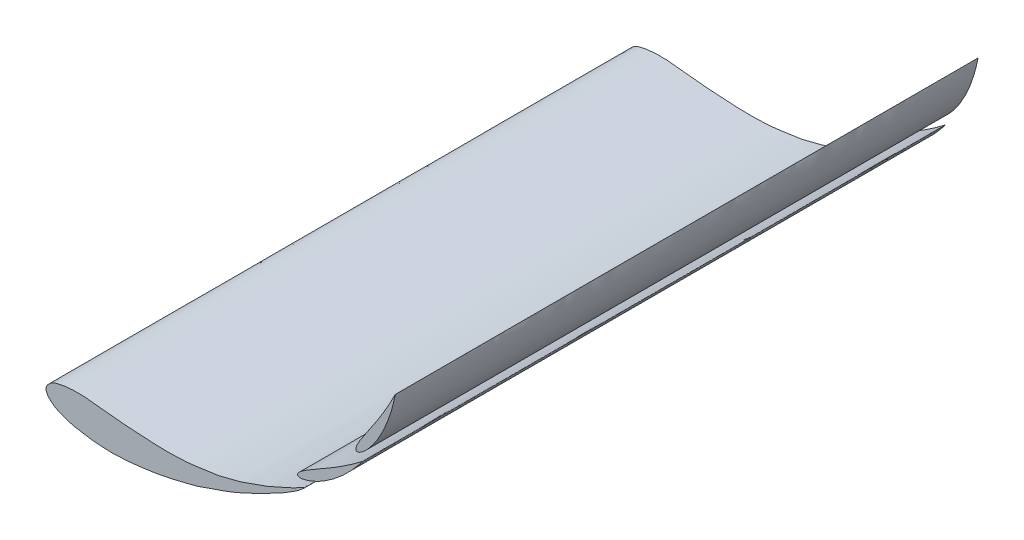
from build123d import *

# Parameters (mm, degrees)
BOSS_EXTRUDE1_DEPTH   = 900
BOSS_EXTRUDE1_2_DEPTH = 900
BOSS_EXTRUDE1_3_DEPTH = 900


with BuildPart() as part:
    # Sketch2 → Boss-Extrude1 (new body)
    with BuildSketch(Plane.XY):
        with BuildLine():
            add(Edge.make_bspline(
                [(0, 0), (-0.65975565, -5.699703464), (8.017548516, -15.480562025), (19.551157506, -21.724015646), (30.016745353, -25.302215165), (39.859962541, -28.8642232), (50.040399275, -30.662933418), (60.070603806, -32.257702331), (70.013877162, -34.217674322), (80.100972933, -34.55999195), (90.093066457, -35.36519438), (100.111969814, -35.952943269), (110.128217778, -35.507216678), (120.153157744, -35.210003546), (130.150331683, -34.229800116), (140.189993261, -33.410162922), (150.178235204, -31.913406007), (160.170449627, -30.371338734), (170.240789754, -29.163640841), (180.208316099, -27.151030087), (190.263801281, -25.306120223), (200.239152099, -22.872450662), (210.244577583, -20.429111012), (220.232934245, -17.895088966), (230.381125348, -15.705438437), (240.351948949, -12.391144832), (253.551193017, -7.369638816), (266.947574476, -2.806549313), (280.436865809, 1.636643436), (290.361357742, 5.819516769), (300.440735094, 10.032227759), (310.304777653, 14.884053202), (323.821431636, 20.884190166), (337.30228202, 27.249833417), (350.274680503, 34.850235797), (364.037447664, 41.200679435), (378.073354269, 50.431878374), (389.268655411, 56.991671546), (404.933124868, 70.670428585), (388.893146181, 60.897261379), (380.961681237, 56.833339948), (370.316551331, 52.173205743), (360.413556578, 47.749137904), (350.469658047, 43.075442492), (340.496714174, 38.833200032), (330.405194537, 35.260956145), (320.349773519, 31.849438488), (310.358327921, 28.32591748), (300.486931551, 24.662169398), (290.321799777, 22.300639283), (280.290360105, 19.76188557), (270.426731207, 16.765017679), (260.335958512, 15.061341224), (250.276874186, 13.958758108), (240.266180313, 12.578254982), (230.278688892, 11.06786106), (220.28670052, 9.696364143), (210.243264635, 9.240413966), (200.228739037, 9.034505305), (190.217040672, 8.279165066), (180.212460889, 9.162360851), (170.184221628, 8.728504773), (160.186505008, 9.582197967), (150.167787888, 9.989196896), (140.163470123, 10.700746944), (130.145958281, 11.214450998), (120.121382338, 11.840881885), (110.132801048, 12.969737489), (100.114836916, 13.850136605), (90.093770057, 14.715857774), (80.079633724, 15.842660607), (56.917746978, 18.847498868), (32.382831952, 18.963380484), (8.41761673, 12.262874152), (0.546057517, 4.717452477), (0, 0)],
                knots=[0, 0, 0, 0, 0.022023736, 0.035622153, 0.048196888, 0.060584536, 0.072602109, 0.084545422, 0.096478612, 0.108283816, 0.120089627, 0.131879307, 0.143660654, 0.15544949, 0.167268546, 0.17910001, 0.190991158, 0.20289685, 0.214787999, 0.226765538, 0.23876847, 0.250863752, 0.262991876, 0.27512, 0.287234564, 0.299600692, 0.31214973, 0.337081787, 0.34954249, 0.362249466, 0.375072168, 0.388091419, 0.401030286, 0.427260863, 0.440708926, 0.453891579, 0.481343844, 0.495528159, 0.510184265, 0.522427916, 0.535732546, 0.548643086, 0.561553626, 0.574510663, 0.587286643, 0.599816472, 0.612271303, 0.624763182, 0.637218013, 0.649381244, 0.661544475, 0.673750263, 0.685718325, 0.697586388, 0.709471547, 0.721375261, 0.733243324, 0.745039761, 0.756824219, 0.768610895, 0.780397571, 0.792175284, 0.803971722, 0.815766061, 0.82756692, 0.839363385, 0.851169099, 0.863005976, 0.874833225, 0.886659586, 0.898509641, 0.910371212, 0.969295412, 0.981771696, 1, 1, 1, 1], degree=3))
        make_face()
    extrude(amount=BOSS_EXTRUDE1_DEPTH)


with BuildPart() as body_2:
    # Sketch2 → Boss-Extrude1 2 (new body)
    with BuildSketch(Plane.XY):
        with BuildLine():
            add(Edge.make_bspline(
                [(488.73992863, 146.276625829), (488.734390863, 146.282664356), (488.424255517, 146.015046997), (488.06224571, 145.78510435), (487.262468982, 145.126312202), (486.219708703, 144.371292999), (484.873478649, 143.336701677), (483.250678892, 142.116067573), (481.344943871, 140.702556836), (479.183854282, 139.108333078), (476.761259361, 137.364331889), (474.123745832, 135.449437464), (471.236790602, 133.439330858), (468.165688429, 131.291310186), (464.896239769, 129.067635846), (461.457519682, 126.769533617), (457.874048726, 124.410588123), (454.151349507, 122.026984888), (450.329646269, 119.608278587), (446.41836705, 117.19210493), (442.442349173, 114.792641259), (438.43193703, 112.415341988), (434.42114363, 110.058907294), (430.419325782, 107.74839744), (426.469079038, 105.475179612), (422.572434597, 103.270040027), (418.782946314, 101.105445668), (415.103822048, 99.01892845), (411.581105321, 96.980001912), (408.223119368, 95.024650916), (405.070149132, 93.117181313), (402.117764879, 91.312769814), (399.415735867, 89.554324386), (396.965291652, 87.893504979), (394.792388291, 86.318571947), (392.915837215, 84.829964237), (391.349809227, 83.430905822), (390.083467317, 82.150893966), (389.152598068, 80.964624913), (388.566460536, 79.872034746), (388.31048608, 78.86894122), (388.452520239, 77.947544055), (389.013376817, 77.204475769), (389.915554573, 76.684991476), (391.128157446, 76.384212118), (392.650081725, 76.254634507), (394.48507873, 76.313765499), (396.623198675, 76.579439281), (399.045948072, 77.035742523), (401.735792151, 77.720460618), (404.675674285, 78.596752435), (407.839178956, 79.704940552), (411.200777121, 81.026852514), (414.720896472, 82.590974299), (418.395557374, 84.341793332), (422.179917585, 86.309143039), (426.045683707, 88.480043342), (429.970357242, 90.828820323), (433.914957703, 93.364526939), (437.871228384, 96.040204149), (441.793376071, 98.866131635), (445.668479549, 101.797178284), (449.465692449, 104.827226536), (453.167907327, 107.924049831), (456.76145535, 111.053999458), (460.202936902, 114.219487851), (463.519091154, 117.342970547), (466.650128692, 120.455005022), (469.613566921, 123.489837804), (472.370170636, 126.450937081), (474.953957291, 129.265647603), (477.297780382, 131.960513478), (479.456204478, 134.463515761), (481.381106749, 136.784579704), (483.077897662, 138.897364919), (484.557730654, 140.769579134), (485.809879979, 142.38248786), (486.847928071, 143.738913606), (487.625844434, 144.768628828), (488.251100258, 145.595659419), (488.480713959, 145.957078055), (488.74539046, 146.270670107), (488.73992863, 146.276625829)],
                knots=[0, 0, 0, 0, 0.000781199, 0.003073574, 0.006930933, 0.012248071, 0.019030102, 0.027225991, 0.036784991, 0.047610037, 0.059602429, 0.072763906, 0.086896902, 0.102003859, 0.117938515, 0.134556032, 0.151857595, 0.169650659, 0.187837924, 0.206373783, 0.225065344, 0.243814112, 0.262569213, 0.281136751, 0.299513586, 0.317505655, 0.335105223, 0.352118009, 0.368487898, 0.384166869, 0.39895523, 0.412906354, 0.425871787, 0.437810597, 0.448585292, 0.458212857, 0.466668993, 0.473884465, 0.479894259, 0.484778924, 0.488742849, 0.492166792, 0.495627983, 0.499576303, 0.504486665, 0.51057614, 0.517942731, 0.526573967, 0.536524046, 0.547640111, 0.560015283, 0.573490911, 0.58803144, 0.603543533, 0.619911609, 0.637089411, 0.654944026, 0.673346428, 0.692212491, 0.711460838, 0.730910148, 0.750475101, 0.77002178, 0.789460649, 0.808651173, 0.827457923, 0.845819698, 0.863558965, 0.880665567, 0.896944906, 0.912322084, 0.926717772, 0.939992516, 0.952161421, 0.963060032, 0.972661788, 0.980906352, 0.987732879, 0.993080076, 0.996902186, 0.999229514, 1, 1, 1, 1], degree=3))
        make_face()
    extrude(amount=BOSS_EXTRUDE1_2_DEPTH)


with BuildPart() as body_3:
    # Sketch2 → Boss-Extrude1 3 (new body)
    with BuildSketch(Plane.XY):
        with BuildLine():
            add(Edge.make_bspline(
                [(539.23992863, 261.033698992), (539.232300477, 261.036691618), (539.071220974, 260.660007341), (538.84698411, 260.294383835), (538.417825195, 259.351147733), (537.812628412, 258.214713723), (537.057592548, 256.69378277), (536.135798945, 254.884204064), (535.044530514, 252.777041307), (533.803223872, 250.395339111), (532.392762892, 247.764189745), (530.864279848, 244.885087007), (529.153510736, 241.810861132), (527.337878898, 238.531830155), (525.377275818, 235.097694518), (523.297285695, 231.52232813), (521.113971493, 227.82870801), (518.816398825, 224.051771346), (516.445296032, 220.199803879), (513.992600523, 216.310761376), (511.474399485, 212.408292537), (508.915559924, 208.510628132), (506.347212063, 204.63154216), (503.766753677, 200.797660602), (501.216247394, 197.019939369), (498.683993851, 193.326930842), (496.230204047, 189.717423878), (493.841272428, 186.226548478), (491.571959726, 182.847140686), (489.413935946, 179.615187713), (487.419075714, 176.516316995), (485.559160111, 173.598156438), (483.903985045, 170.831274842), (482.431961132, 168.262626571), (481.171565959, 165.893066494), (480.139507952, 163.731252802), (479.34710268, 161.786307292), (478.771655483, 160.079971306), (478.456434932, 158.605231474), (478.409787964, 157.366097849), (478.620462539, 156.352412898), (479.152841571, 155.586972786), (479.983174935, 155.165741091), (481.021950668, 155.095331463), (482.243553358, 155.357787717), (483.667859402, 155.909945444), (485.29054848, 156.769181737), (487.094846627, 157.947148926), (489.071128932, 159.421425429), (491.187042136, 161.2182568), (493.443445817, 163.29704995), (495.798893171, 165.68242869), (498.238430573, 168.346851015), (500.713990203, 171.298526321), (503.24638307, 174.485830725), (505.782214613, 177.91586918), (508.30176656, 181.564550428), (510.796103474, 185.398924032), (513.226226138, 189.409999652), (515.60534525, 193.551959475), (517.887801758, 197.813922504), (520.081812496, 202.149664133), (522.16235077, 206.540137267), (524.128203332, 210.948872483), (525.981871124, 215.33963319), (527.683301699, 219.695521508), (529.290584132, 223.958613558), (530.736576407, 228.13009856), (532.065902489, 232.158595228), (533.241787684, 236.029983649), (534.326712468, 239.693930018), (535.248687863, 243.14478577), (536.088375508, 246.341815089), (536.798178994, 249.272795142), (537.394530655, 251.916437039), (537.901637286, 254.248627252), (538.318092286, 256.247821862), (538.654858961, 257.922523501), (538.901431694, 259.189414684), (539.099884418, 260.207139124), (539.147412047, 260.632726817), (539.247452181, 261.030747402), (539.23992863, 261.033698992)],
                knots=[0, 0, 0, 0, 0.000781199, 0.003073574, 0.006930933, 0.012248071, 0.019030102, 0.027225991, 0.036784991, 0.047610037, 0.059602429, 0.072763906, 0.086896902, 0.102003859, 0.117938515, 0.134556032, 0.151857595, 0.169650659, 0.187837924, 0.206373783, 0.225065344, 0.243814112, 0.262569213, 0.281136751, 0.299513586, 0.317505655, 0.335105223, 0.352118009, 0.368487898, 0.384166869, 0.39895523, 0.412906354, 0.425871787, 0.437810597, 0.448585292, 0.458212857, 0.466668993, 0.473884465, 0.479894259, 0.484778924, 0.488742849, 0.492166792, 0.495627983, 0.499576303, 0.504486665, 0.51057614, 0.517942731, 0.526573967, 0.536524046, 0.547640111, 0.560015283, 0.573490911, 0.58803144, 0.603543533, 0.619911609, 0.637089411, 0.654944026, 0.673346428, 0.692212491, 0.711460838, 0.730910148, 0.750475101, 0.77002178, 0.789460649, 0.808651173, 0.827457923, 0.845819698, 0.863558965, 0.880665567, 0.896944906, 0.912322084, 0.926717772, 0.939992516, 0.952161421, 0.963060032, 0.972661788, 0.980906352, 0.987732879, 0.993080076, 0.996902186, 0.999229514, 1, 1, 1, 1], degree=3))
        make_face()
    extrude(amount=BOSS_EXTRUDE1_3_DEPTH)


solid = Compound([part.part, body_2.part, body_3.part])
